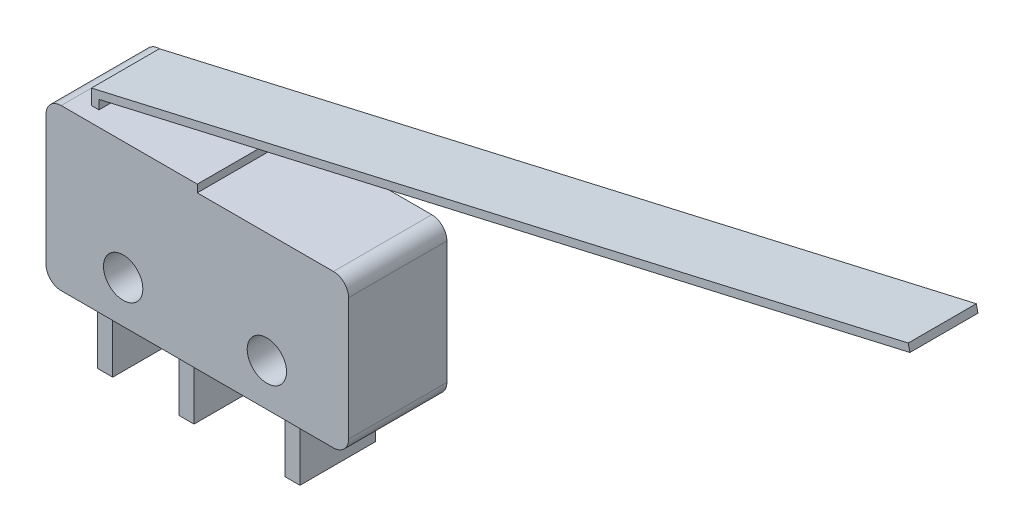
from build123d import *

# Parameters (mm, degrees)
BOSS_EXTRUDE1_DEPTH  = 6.5
FILLET1_R            = 1
M2_CLEARANCE_HOLE1_D = 2.6
BOSS_EXTRUDE2_START  = -1
BOSS_EXTRUDE2_DEPTH  = 4.5
SKETCH6_W            = 1
SKETCH6_H            = 5
BOSS_EXTRUDE3_DEPTH  = 4


with BuildPart() as part:
    # Sketch1 → Boss-Extrude1 (new body)
    with BuildSketch(Plane.XY):
        Polygon((10, 10.6), (10, 10.1), (20, 10.1), (20, 0), (0, 0), (0, 10.6), align=None)
    extrude(amount=BOSS_EXTRUDE1_DEPTH)

    # Fillet1
    fillet1_edges = [part.edges().sort_by_distance(p)[0] for p in [
        (0, 10.6, 3.25),
        (20, 10.1, 3.25),
        (20, 0, 3.25),
        (0, 0, 3.25),
    ]]
    fillet(fillet1_edges, radius=FILLET1_R)

    # M2 Clearance Hole1 (through all)
    with Locations(Plane.XY.offset(6.5)):
        with Locations((5.1, 2.8), (14.6, 2.8)):
            Hole(M2_CLEARANCE_HOLE1_D / 2)

    # Sketch5 → Boss-Extrude2 (add)
    with BuildSketch(Plane.XY.offset(6.5).offset(BOSS_EXTRUDE2_START)):
        Polygon((2, 11.6), (2, 10.6), (2.5, 10.6), (2.5, 11.201813956), (56.104500003, 23.512686364), (55.992582981, 24), align=None)
    extrude(amount=-BOSS_EXTRUDE2_DEPTH)

    # Sketch6 → Boss-Extrude3 (add)
    with BuildSketch(Plane.XZ):
        with Locations((3.159009098, 3.25)):
            Rectangle(SKETCH6_W, SKETCH6_H)
        with Locations((8.531370471, 3.25)):
            Rectangle(SKETCH6_W, SKETCH6_H)
        with Locations((15.53592061, 3.25)):
            Rectangle(SKETCH6_W, SKETCH6_H)
    extrude(amount=BOSS_EXTRUDE3_DEPTH)


solid = part.part
